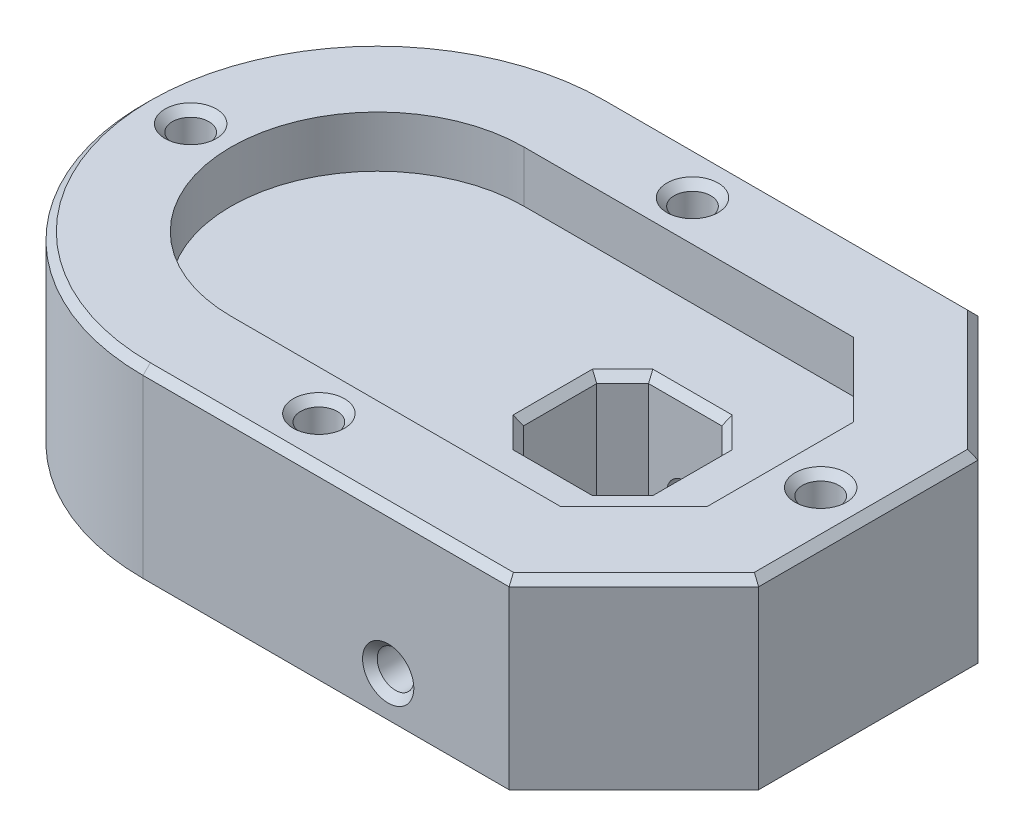
from build123d import *

# Parameters (mm, degrees)
BOSS_EXTRUDE1_DEPTH     = 18
CUT_EXTRUDE1_DEPTH      = 18
EXTRUDE_THIN1_DEPTH     = 25
CUT_EXTRUDE2_DEPTH      = 77.021378572
CUT_EXTRUDE2_DEPTH_BACK = 77.021378572
SKETCH3_R               = 2.5
CHAMFER1_SIZE           = 1
CUT_EXTRUDE3_DEPTH      = 65.02538559
CUT_EXTRUDE3_DEPTH_BACK = 65.02538559
SKETCH6_R               = 2.5
CHAMFER3_SIZE           = 1


with BuildPart() as part:
    # Sketch1 → Boss-Extrude1 (new body)
    with BuildSketch(Plane(origin=(0, 0, 0), x_dir=(1, 0, 0), z_dir=(0, 1, 0))):
        with BuildLine():
            Line((37.5, -10), (37.5, 10))
            Line((37.5, 10), (27.5, 20))
            Line((27.5, 20), (-17.5, 20))
            ThreePointArc((-17.5, 20), (-31.64213568, 14.142135567), (-37.5, -1.6e-07))
            ThreePointArc((-37.5, -1.6e-07), (-31.642135567, -14.14213568), (-17.5, -20))
            Line((-17.5, -20), (27.5, -20))
            Line((27.5, -20), (37.5, -10))
        make_face()
    extrude(amount=BOSS_EXTRUDE1_DEPTH)

    # Sketch2 → Cut-Extrude1 (cut)
    with BuildSketch(Plane.XZ):
        Polygon((24.5, 5), (24.5, -5), (20.964466094, -8.535533906), (10.964466094, -8.535533906), (7.428932188, -5), (7.428932188, 5), (10.964466094, 8.535533906), (20.964466094, 8.535533906), align=None)
    extrude(amount=-CUT_EXTRUDE1_DEPTH, mode=Mode.SUBTRACT)

    # Sketch4 → Extrude-Thin1 (add)
    with BuildSketch(Plane.XZ):
        with BuildLine():
            Line((-17.5, -32), (32.470562748, -32))
            Line((32.470562748, -32), (49.5, -14.970562748))
            Line((49.5, -14.970562748), (49.5, 14.970562748))
            Line((49.5, 14.970562748), (32.470562748, 32))
            Line((32.470562748, 32), (-17.5, 32))
            ThreePointArc((-17.5, 32), (-49.5, 0), (-17.5, -32))
        make_face()
        with BuildLine():
            Line((-17.5, -20), (27.5, -20))
            Line((27.5, -20), (37.5, -10))
            Line((37.5, -10), (37.5, 10))
            Line((37.5, 10), (27.5, 20))
            Line((27.5, 20), (-17.5, 20))
            ThreePointArc((-17.5, 20), (-37.5, 0), (-17.5, -20))
        make_face(mode=Mode.SUBTRACT)
    extrude(amount=-EXTRUDE_THIN1_DEPTH)

    # Sketch3 → Cut-Extrude2 (cut, two sides: drawn at the far end of the back side and taken through both)
    with BuildSketch(Plane.XY.offset(20).offset(-CUT_EXTRUDE2_DEPTH_BACK)):
        with Locations((15.964466094, 5.5)):
            Circle(SKETCH3_R)
    extrude(amount=CUT_EXTRUDE2_DEPTH + CUT_EXTRUDE2_DEPTH_BACK, mode=Mode.SUBTRACT)

    # Chamfer1
    chamfer1_edges = [part.edges().sort_by_distance(p)[0] for p in [
        (15.964466094, 0, 8.535533906),
        (9.196699141, 0, 6.767766953),
        (7.428932188, 0, 0),
        (9.196699141, 0, -6.767766953),
        (15.964466094, 0, -8.535533906),
        (22.732233047, 0, -6.767766953),
        (24.5, 0, 0),
        (22.732233047, 0, 6.767766953),
        (9.196699141, 18, 6.767766953),
        (7.428932188, 18, 0),
        (9.196699141, 18, -6.767766953),
        (15.964466094, 18, -8.535533906),
        (22.732233047, 18, -6.767766953),
        (24.5, 18, 0),
        (22.732233047, 18, 6.767766953),
        (15.964466094, 18, 8.535533906),
        (-49.5, 25, 0),
        (7.485281374, 25, 32),
        (40.985281374, 25, 23.485281374),
        (49.5, 25, 0),
        (40.985281374, 25, -23.485281374),
        (7.485281374, 25, -32),
        (13.464466094, 5.5, -32),
        (13.464466094, 5.5, 32),
    ]]
    chamfer(chamfer1_edges, length=CHAMFER1_SIZE)

    # Sketch6 → Cut-Extrude3 (cut, two sides: drawn at the far end of the back side and taken through both)
    with BuildSketch(Plane(origin=(0, 25, 0), x_dir=(1, 0, 0), z_dir=(0, 1, 0)).offset(-CUT_EXTRUDE3_DEPTH_BACK)):
        with Locations(Location((0, 25.5, 0), (0, 0, 270))):
            Circle(SKETCH6_R)
        with Locations(Location((0, -25.5, 0), (0, 0, 270))):
            Circle(SKETCH6_R)
        with Locations(Location((43, 0, 0), (0, 0, 270))):
            Circle(SKETCH6_R)
        with Locations(Location((-43, 0, 0), (0, 0, 270))):
            Circle(SKETCH6_R)
    extrude(amount=CUT_EXTRUDE3_DEPTH + CUT_EXTRUDE3_DEPTH_BACK, mode=Mode.SUBTRACT)

    # Chamfer3
    chamfer3_edges = [part.edges().sort_by_distance(p)[0] for p in [
        (0, 25, -28),
        (0, 25, 23),
        (43, 25, -2.5),
        (-43, 25, -2.5),
    ]]
    chamfer(chamfer3_edges, length=CHAMFER3_SIZE)


solid = part.part
